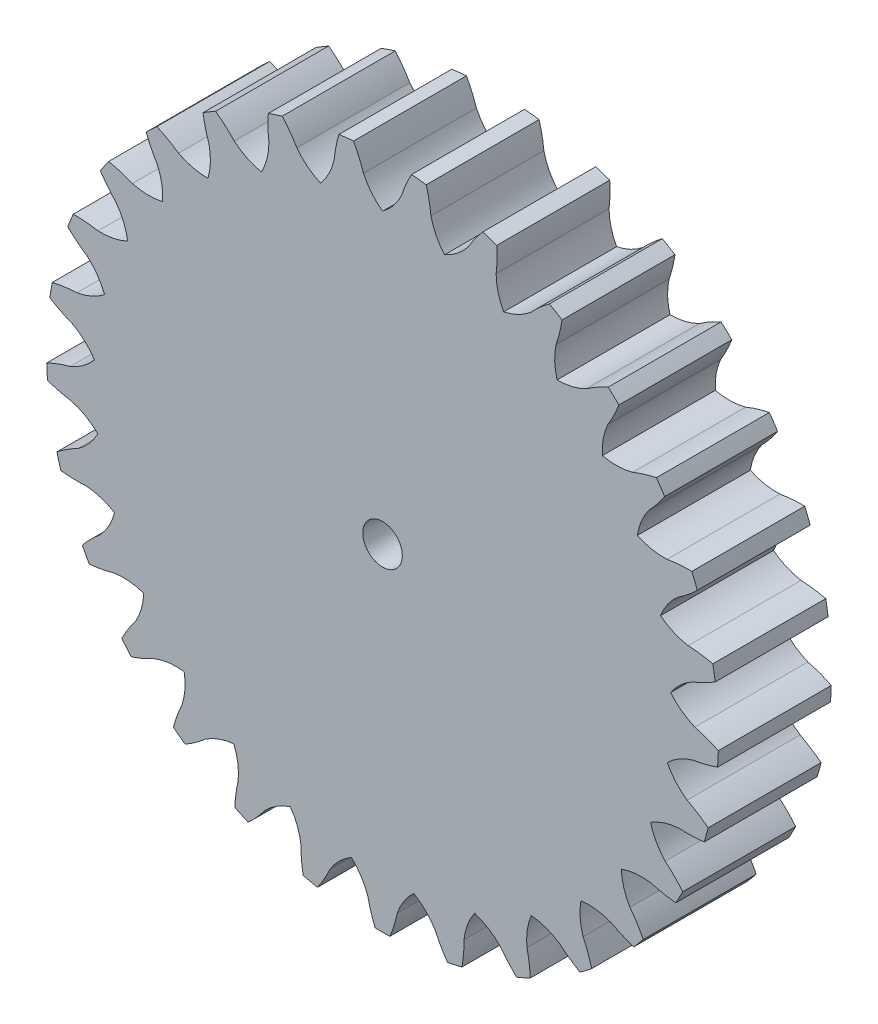
from build123d import *

# Parameters (mm, degrees)
SKETCH1_R           = 29.75
SKETCH1_R_2         = 1.75
BOSS_EXTRUDE1_DEPTH = 10
CUT_EXTRUDE1_DEPTH  = 44.244941901
CIRPATTERN1_COUNT   = 29


with BuildPart() as part:
    # Sketch1 → Boss-Extrude1 (new body)
    with BuildSketch(Plane.XY):
        Circle(SKETCH1_R)
        Circle(SKETCH1_R_2, mode=Mode.SUBTRACT)
    extrude(amount=BOSS_EXTRUDE1_DEPTH)

    # Sketch2 → Cut-Extrude1 (cut, through all)
    with BuildSketch(Plane.XY):
        with BuildLine():
            ThreePointArc((0, 25.543580948), (-0.974317868, 26.472596764), (-1.690877269, 27.612293356))
            ThreePointArc((-1.690877269, 27.612293356), (-3.707498788, 31.338974425), (-6.921804626, 34.099980061))
            ThreePointArc((-6.921804626, 34.099980061), (-3.661433163, 35.923952851), (0, 36.666115912))
            ThreePointArc((0, 36.666115912), (3.661433163, 35.923952851), (6.921804626, 34.099980061))
            ThreePointArc((6.921804626, 34.099980061), (3.707498788, 31.338974425), (1.690877269, 27.612293356))
            ThreePointArc((1.690877269, 27.612293356), (0.974317868, 26.472596764), (0, 25.543580948))
        make_face()
    cut_extrude1 = extrude(amount=CUT_EXTRUDE1_DEPTH, mode=Mode.SUBTRACT)

    # CirPattern1: Cut-Extrude1 ×29 about axis
    cirpattern1_axis = Axis((0, 0, 0), (0, 0, 1))
    for i in range(1, CIRPATTERN1_COUNT):
        add(cut_extrude1.rotate(cirpattern1_axis, i * 360 / CIRPATTERN1_COUNT), mode=Mode.SUBTRACT)


solid = part.part
